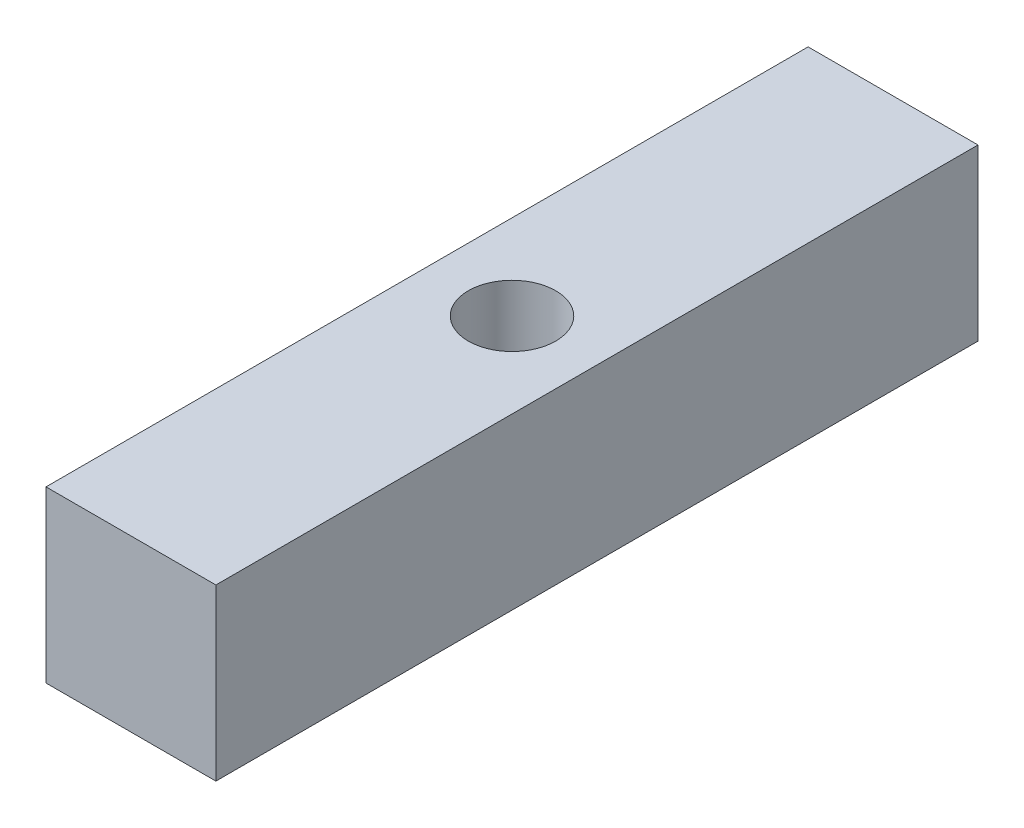
from build123d import *

# Parameters (mm, degrees)
SKETCH1_W           = 8.89
SKETCH1_H           = 39.878
SKETCH1_R           = 2.286
BOSS_EXTRUDE1_DEPTH = 8.89


with BuildPart() as part:
    # Sketch1 → Boss-Extrude1 (new body)
    with BuildSketch(Plane(origin=(0, 0, 0), x_dir=(1, 0, 0), z_dir=(0, 1, 0))):
        Rectangle(SKETCH1_W, SKETCH1_H)
        with Locations(Location((0, 0, 0), (0, 0, 270))):
            Circle(SKETCH1_R, mode=Mode.SUBTRACT)
    extrude(amount=BOSS_EXTRUDE1_DEPTH)


solid = part.part
